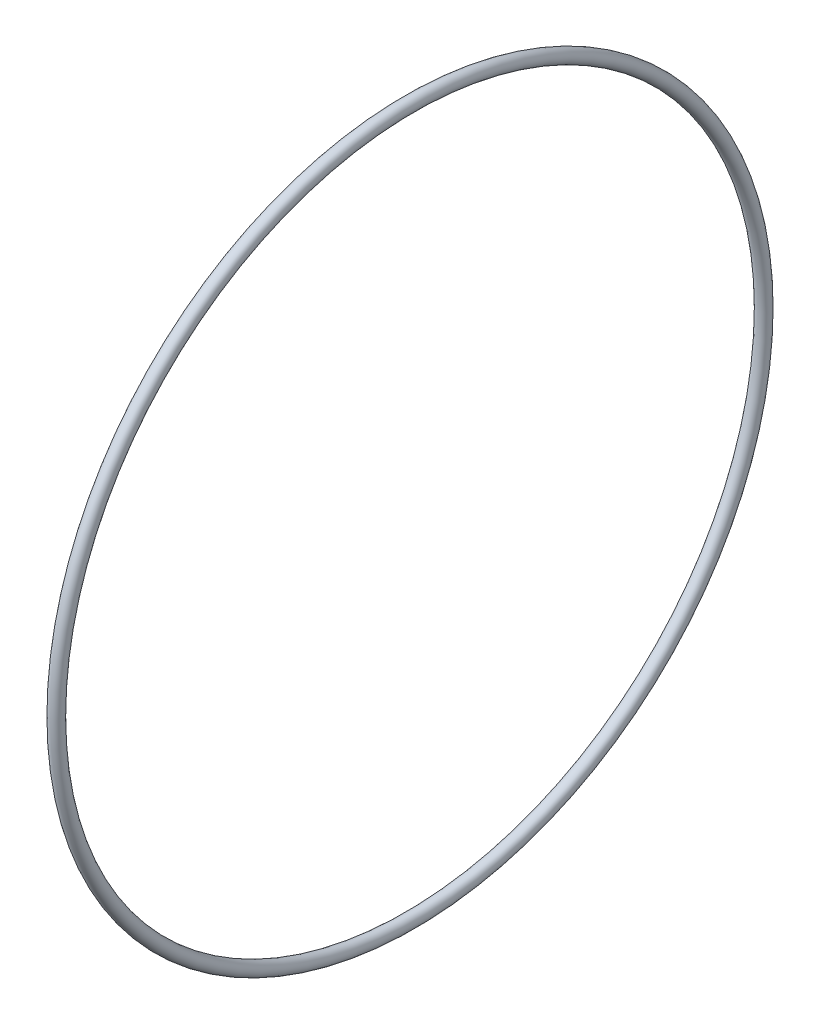
from build123d import *

# Parameters (mm, degrees)
SKETCH3_R = 2.667


with BuildPart() as part:
    # Sweep1: sweep along a path in Sketch1
    with BuildLine(Plane(origin=(0, 0, 0), x_dir=(0, 0, -1), z_dir=(1, 0, 0))) as sweep1_path:
        CenterArc((0, 0), 139.3825, 0, 360)
    # Sketch3 → Sweep1 (sweep)
    with BuildSketch(Plane.XY):
        with Locations((0, 142.0495)):
            Circle(SKETCH3_R)
    sweep(path=sweep1_path.line)


solid = part.part
